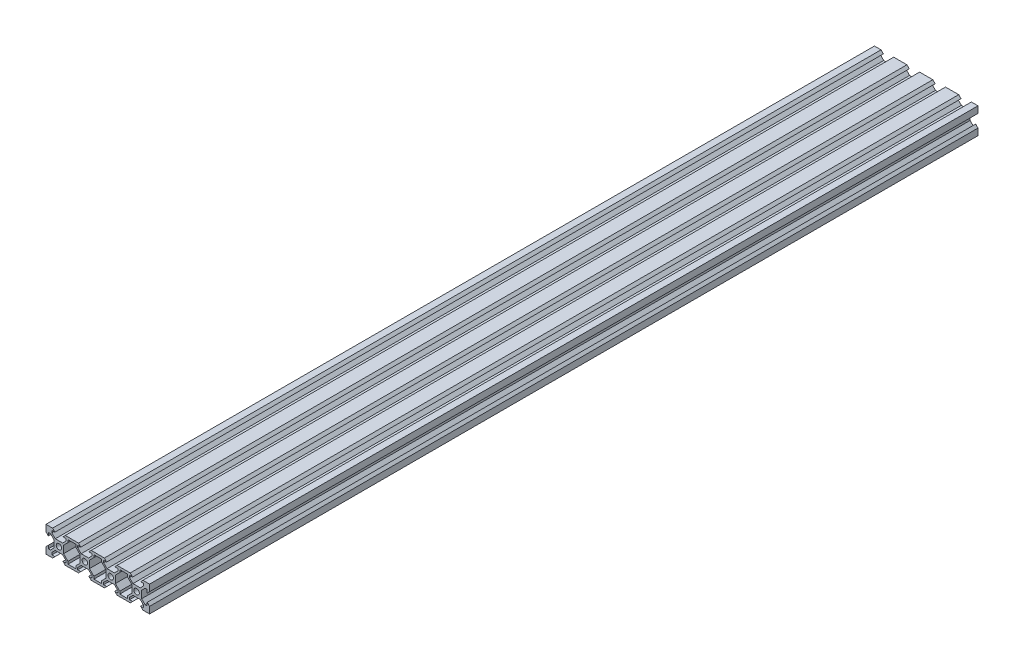
from build123d import *

# Parameters (mm, degrees)
ESQUISSE1_W             = 80
ESQUISSE1_H             = 20
BOSS_EXTRU_1_DEPTH      = 640
ENL_V_MAT_EXTRU_1_REACH = 645.463
ESQUISSE2_R             = 2.1
ENL_V_MAT_EXTRU_2_REACH = 645.463


with BuildPart() as part:
    # Esquisse1 → Boss.-Extru.1 (new body)
    with BuildSketch(Plane.XY):
        with Locations((-25.62771875, -1.733873274)):
            Rectangle(ESQUISSE1_W, ESQUISSE1_H)
    extrude(amount=BOSS_EXTRU_1_DEPTH)

    # Esquisse2 → Enlèv. mat.-Extru.1 (cut, up to next)
    with BuildSketch(Plane(origin=(0, 0, 0), x_dir=(-1, 0, 0), z_dir=(0, 0, -1)), mode=Mode.PRIVATE) as enl_v_mat_extru_1_sk1:
        with Locations((55.62771875, -1.733873274)):
            Circle(ESQUISSE2_R)
    enl_v_mat_extru_1_tool1 = extrude(enl_v_mat_extru_1_sk1.sketch, amount=-ENL_V_MAT_EXTRU_1_REACH, mode=Mode.PRIVATE) & part.part
    # Esquisse2 → Enlèv. mat.-Extru.1 (cut, up to next)
    with BuildSketch(Plane(origin=(0, 0, 0), x_dir=(-1, 0, 0), z_dir=(0, 0, -1)), mode=Mode.PRIVATE) as enl_v_mat_extru_1_sk2:
        with Locations((35.62771875, -1.733873274)):
            Circle(ESQUISSE2_R)
    enl_v_mat_extru_1_tool2 = extrude(enl_v_mat_extru_1_sk2.sketch, amount=-ENL_V_MAT_EXTRU_1_REACH, mode=Mode.PRIVATE) & part.part
    # Esquisse2 → Enlèv. mat.-Extru.1 (cut, up to next)
    with BuildSketch(Plane(origin=(0, 0, 0), x_dir=(-1, 0, 0), z_dir=(0, 0, -1)), mode=Mode.PRIVATE) as enl_v_mat_extru_1_sk3:
        with Locations((15.62771875, -1.733873274)):
            Circle(ESQUISSE2_R)
    enl_v_mat_extru_1_tool3 = extrude(enl_v_mat_extru_1_sk3.sketch, amount=-ENL_V_MAT_EXTRU_1_REACH, mode=Mode.PRIVATE) & part.part
    # Esquisse2 → Enlèv. mat.-Extru.1 (cut, up to next)
    with BuildSketch(Plane(origin=(0, 0, 0), x_dir=(-1, 0, 0), z_dir=(0, 0, -1)), mode=Mode.PRIVATE) as enl_v_mat_extru_1_sk4:
        with Locations((-4.37228125, -1.733873274)):
            Circle(ESQUISSE2_R)
    enl_v_mat_extru_1_tool4 = extrude(enl_v_mat_extru_1_sk4.sketch, amount=-ENL_V_MAT_EXTRU_1_REACH, mode=Mode.PRIVATE) & part.part
    # Esquisse2 → Enlèv. mat.-Extru.1 (cut, up to next)
    with BuildSketch(Plane(origin=(0, 0, 0), x_dir=(-1, 0, 0), z_dir=(0, 0, -1)), mode=Mode.PRIVATE) as enl_v_mat_extru_1_sk5:
        Polygon((50.72771875, 8.266126726), (60.52771875, 8.266126726), (58.72771875, 6.466126726), (61.12771875, 6.466126726), (61.12771875, 4.826126726), (58.46771875, 2.166126726), (52.78771875, 2.166126726), (50.12771875, 4.826126726), (50.12771875, 6.466126726), (52.52771875, 6.466126726), align=None)
    enl_v_mat_extru_1_tool5 = extrude(enl_v_mat_extru_1_sk5.sketch, amount=-ENL_V_MAT_EXTRU_1_REACH, mode=Mode.PRIVATE) & part.part
    # Esquisse2 → Enlèv. mat.-Extru.1 (cut, up to next)
    with BuildSketch(Plane(origin=(0, 0, 0), x_dir=(-1, 0, 0), z_dir=(0, 0, -1)), mode=Mode.PRIVATE) as enl_v_mat_extru_1_sk6:
        Polygon((65.62771875, 3.166126726), (65.62771875, -6.633873274), (63.82771875, -4.833873274), (63.82771875, -7.233873274), (62.18771875, -7.233873274), (59.52771875, -4.573873274), (59.52771875, 1.106126726), (62.18771875, 3.766126726), (63.82771875, 3.766126726), (63.82771875, 1.366126726), align=None)
    enl_v_mat_extru_1_tool6 = extrude(enl_v_mat_extru_1_sk6.sketch, amount=-ENL_V_MAT_EXTRU_1_REACH, mode=Mode.PRIVATE) & part.part
    # Esquisse2 → Enlèv. mat.-Extru.1 (cut, up to next)
    with BuildSketch(Plane(origin=(0, 0, 0), x_dir=(-1, 0, 0), z_dir=(0, 0, -1)), mode=Mode.PRIVATE) as enl_v_mat_extru_1_sk7:
        Polygon((60.52771875, -11.733873274), (50.72771875, -11.733873274), (52.52771875, -9.933873274), (50.12771875, -9.933873274), (50.12771875, -8.293873274), (52.78771875, -5.633873274), (58.46771875, -5.633873274), (61.12771875, -8.293873274), (61.12771875, -9.933873274), (58.72771875, -9.933873274), align=None)
    enl_v_mat_extru_1_tool7 = extrude(enl_v_mat_extru_1_sk7.sketch, amount=-ENL_V_MAT_EXTRU_1_REACH, mode=Mode.PRIVATE) & part.part
    # Esquisse2 → Enlèv. mat.-Extru.1 (cut, up to next)
    with BuildSketch(Plane(origin=(0, 0, 0), x_dir=(-1, 0, 0), z_dir=(0, 0, -1)), mode=Mode.PRIVATE) as enl_v_mat_extru_1_sk8:
        Polygon((30.72771875, 8.266126726), (40.52771875, 8.266126726), (38.72771875, 6.466126726), (41.12771875, 6.466126726), (41.12771875, 4.826126726), (38.46771875, 2.166126726), (32.78771875, 2.166126726), (30.12771875, 4.826126726), (30.12771875, 6.466126726), (32.52771875, 6.466126726), align=None)
    enl_v_mat_extru_1_tool8 = extrude(enl_v_mat_extru_1_sk8.sketch, amount=-ENL_V_MAT_EXTRU_1_REACH, mode=Mode.PRIVATE) & part.part
    # Esquisse2 → Enlèv. mat.-Extru.1 (cut, up to next)
    with BuildSketch(Plane(origin=(0, 0, 0), x_dir=(-1, 0, 0), z_dir=(0, 0, -1)), mode=Mode.PRIVATE) as enl_v_mat_extru_1_sk9:
        Polygon((40.52771875, -11.733873274), (30.72771875, -11.733873274), (32.52771875, -9.933873274), (30.12771875, -9.933873274), (30.12771875, -8.293873274), (32.78771875, -5.633873274), (38.46771875, -5.633873274), (41.12771875, -8.293873274), (41.12771875, -9.933873274), (38.72771875, -9.933873274), align=None)
    enl_v_mat_extru_1_tool9 = extrude(enl_v_mat_extru_1_sk9.sketch, amount=-ENL_V_MAT_EXTRU_1_REACH, mode=Mode.PRIVATE) & part.part
    # Esquisse2 → Enlèv. mat.-Extru.1 (cut, up to next)
    with BuildSketch(Plane(origin=(0, 0, 0), x_dir=(-1, 0, 0), z_dir=(0, 0, -1)), mode=Mode.PRIVATE) as enl_v_mat_extru_1_sk10:
        Polygon((10.72771875, 8.266126726), (20.52771875, 8.266126726), (18.72771875, 6.466126726), (21.12771875, 6.466126726), (21.12771875, 4.826126726), (18.46771875, 2.166126726), (12.78771875, 2.166126726), (10.12771875, 4.826126726), (10.12771875, 6.466126726), (12.52771875, 6.466126726), align=None)
    enl_v_mat_extru_1_tool10 = extrude(enl_v_mat_extru_1_sk10.sketch, amount=-ENL_V_MAT_EXTRU_1_REACH, mode=Mode.PRIVATE) & part.part
    # Esquisse2 → Enlèv. mat.-Extru.1 (cut, up to next)
    with BuildSketch(Plane(origin=(0, 0, 0), x_dir=(-1, 0, 0), z_dir=(0, 0, -1)), mode=Mode.PRIVATE) as enl_v_mat_extru_1_sk11:
        Polygon((20.52771875, -11.733873274), (10.72771875, -11.733873274), (12.52771875, -9.933873274), (10.12771875, -9.933873274), (10.12771875, -8.293873274), (12.78771875, -5.633873274), (18.46771875, -5.633873274), (21.12771875, -8.293873274), (21.12771875, -9.933873274), (18.72771875, -9.933873274), align=None)
    enl_v_mat_extru_1_tool11 = extrude(enl_v_mat_extru_1_sk11.sketch, amount=-ENL_V_MAT_EXTRU_1_REACH, mode=Mode.PRIVATE) & part.part
    # Esquisse2 → Enlèv. mat.-Extru.1 (cut, up to next)
    with BuildSketch(Plane(origin=(0, 0, 0), x_dir=(-1, 0, 0), z_dir=(0, 0, -1)), mode=Mode.PRIVATE) as enl_v_mat_extru_1_sk12:
        Polygon((-9.27228125, 8.266126726), (0.52771875, 8.266126726), (-1.27228125, 6.466126726), (1.12771875, 6.466126726), (1.12771875, 4.826126726), (-1.53228125, 2.166126726), (-7.21228125, 2.166126726), (-9.87228125, 4.826126726), (-9.87228125, 6.466126726), (-7.47228125, 6.466126726), align=None)
    enl_v_mat_extru_1_tool12 = extrude(enl_v_mat_extru_1_sk12.sketch, amount=-ENL_V_MAT_EXTRU_1_REACH, mode=Mode.PRIVATE) & part.part
    # Esquisse2 → Enlèv. mat.-Extru.1 (cut, up to next)
    with BuildSketch(Plane(origin=(0, 0, 0), x_dir=(-1, 0, 0), z_dir=(0, 0, -1)), mode=Mode.PRIVATE) as enl_v_mat_extru_1_sk13:
        Polygon((0.52771875, -11.733873274), (-9.27228125, -11.733873274), (-7.47228125, -9.933873274), (-9.87228125, -9.933873274), (-9.87228125, -8.293873274), (-7.21228125, -5.633873274), (-1.53228125, -5.633873274), (1.12771875, -8.293873274), (1.12771875, -9.933873274), (-1.27228125, -9.933873274), align=None)
    enl_v_mat_extru_1_tool13 = extrude(enl_v_mat_extru_1_sk13.sketch, amount=-ENL_V_MAT_EXTRU_1_REACH, mode=Mode.PRIVATE) & part.part
    # Esquisse2 → Enlèv. mat.-Extru.1 (cut, up to next)
    with BuildSketch(Plane(origin=(0, 0, 0), x_dir=(-1, 0, 0), z_dir=(0, 0, -1)), mode=Mode.PRIVATE) as enl_v_mat_extru_1_sk14:
        Polygon((-14.37228125, -6.633873274), (-14.37228125, 3.166126726), (-12.57228125, 1.366126726), (-12.57228125, 3.766126726), (-10.93228125, 3.766126726), (-8.27228125, 1.106126726), (-8.27228125, -4.573873274), (-10.93228125, -7.233873274), (-12.57228125, -7.233873274), (-12.57228125, -4.833873274), align=None)
    enl_v_mat_extru_1_tool14 = extrude(enl_v_mat_extru_1_sk14.sketch, amount=-ENL_V_MAT_EXTRU_1_REACH, mode=Mode.PRIVATE) & part.part
    add(enl_v_mat_extru_1_tool1.solids().sort_by_distance((-55.627719, -1.733873, 0))[0], mode=Mode.SUBTRACT)
    add(enl_v_mat_extru_1_tool2.solids().sort_by_distance((-35.627719, -1.733873, 0))[0], mode=Mode.SUBTRACT)
    add(enl_v_mat_extru_1_tool3.solids().sort_by_distance((-15.627719, -1.733873, 0))[0], mode=Mode.SUBTRACT)
    add(enl_v_mat_extru_1_tool4.solids().sort_by_distance((4.372281, -1.733873, 0))[0], mode=Mode.SUBTRACT)
    add(enl_v_mat_extru_1_tool5.solids().sort_by_distance((-55.627719, 5.301599, 0))[0], mode=Mode.SUBTRACT)
    add(enl_v_mat_extru_1_tool6.solids().sort_by_distance((-62.663191, -1.733873, 0))[0], mode=Mode.SUBTRACT)
    add(enl_v_mat_extru_1_tool7.solids().sort_by_distance((-55.627719, -8.769346, 0))[0], mode=Mode.SUBTRACT)
    add(enl_v_mat_extru_1_tool8.solids().sort_by_distance((-35.627719, 5.301599, 0))[0], mode=Mode.SUBTRACT)
    add(enl_v_mat_extru_1_tool9.solids().sort_by_distance((-35.627719, -8.769346, 0))[0], mode=Mode.SUBTRACT)
    add(enl_v_mat_extru_1_tool10.solids().sort_by_distance((-15.627719, 5.301599, 0))[0], mode=Mode.SUBTRACT)
    add(enl_v_mat_extru_1_tool11.solids().sort_by_distance((-15.627719, -8.769346, 0))[0], mode=Mode.SUBTRACT)
    add(enl_v_mat_extru_1_tool12.solids().sort_by_distance((4.372281, 5.301599, 0))[0], mode=Mode.SUBTRACT)
    add(enl_v_mat_extru_1_tool13.solids().sort_by_distance((4.372281, -8.769346, 0))[0], mode=Mode.SUBTRACT)
    add(enl_v_mat_extru_1_tool14.solids().sort_by_distance((11.407754, -1.733873, 0))[0], mode=Mode.SUBTRACT)

    # Esquisse3 → Enlèv. mat.-Extru.2 (cut, up to next)
    with BuildSketch(Plane(origin=(0, 0, 0), x_dir=(-1, 0, 0), z_dir=(0, 0, -1)), mode=Mode.PRIVATE) as enl_v_mat_extru_2_sk1:
        Polygon((2.618256699, 6.466126726), (8.637180802, 6.466126726), (8.637180802, 4.506126726), (12.037180802, 1.106126726), (12.037180802, -4.573873274), (8.637180802, -7.973873274), (8.637180802, -9.933873274), (2.618256699, -9.933873274), (2.618256699, -7.973873274), (-0.781743301, -4.573873274), (-0.781743301, 1.106126726), (2.618256699, 4.506126726), align=None)
    enl_v_mat_extru_2_tool1 = extrude(enl_v_mat_extru_2_sk1.sketch, amount=-ENL_V_MAT_EXTRU_2_REACH, mode=Mode.PRIVATE) & part.part
    # Esquisse3 → Enlèv. mat.-Extru.2 (cut, up to next)
    with BuildSketch(Plane(origin=(0, 0, 0), x_dir=(-1, 0, 0), z_dir=(0, 0, -1)), mode=Mode.PRIVATE) as enl_v_mat_extru_2_sk2:
        Polygon((22.618256699, 6.466126726), (28.637180802, 6.466126726), (28.637180802, 4.506126726), (32.037180802, 1.106126726), (32.037180802, -4.573873274), (28.637180802, -7.973873274), (28.637180802, -9.933873274), (22.618256699, -9.933873274), (22.618256699, -7.973873274), (19.218256699, -4.573873274), (19.218256699, 1.106126726), (22.618256699, 4.506126726), align=None)
    enl_v_mat_extru_2_tool2 = extrude(enl_v_mat_extru_2_sk2.sketch, amount=-ENL_V_MAT_EXTRU_2_REACH, mode=Mode.PRIVATE) & part.part
    # Esquisse3 → Enlèv. mat.-Extru.2 (cut, up to next)
    with BuildSketch(Plane(origin=(0, 0, 0), x_dir=(-1, 0, 0), z_dir=(0, 0, -1)), mode=Mode.PRIVATE) as enl_v_mat_extru_2_sk3:
        Polygon((42.618256699, 6.466126726), (48.637180802, 6.466126726), (48.637180802, 4.506126726), (52.037180802, 1.106126726), (52.037180802, -4.573873274), (48.637180802, -7.973873274), (48.637180802, -9.933873274), (42.618256699, -9.933873274), (42.618256699, -7.973873274), (39.218256699, -4.573873274), (39.218256699, 1.106126726), (42.618256699, 4.506126726), align=None)
    enl_v_mat_extru_2_tool3 = extrude(enl_v_mat_extru_2_sk3.sketch, amount=-ENL_V_MAT_EXTRU_2_REACH, mode=Mode.PRIVATE) & part.part
    add(enl_v_mat_extru_2_tool1.solids().sort_by_distance((-5.627719, -1.733873, 0))[0], mode=Mode.SUBTRACT)
    add(enl_v_mat_extru_2_tool2.solids().sort_by_distance((-25.627719, -1.733873, 0))[0], mode=Mode.SUBTRACT)
    add(enl_v_mat_extru_2_tool3.solids().sort_by_distance((-45.627719, -1.733873, 0))[0], mode=Mode.SUBTRACT)


solid = part.part
